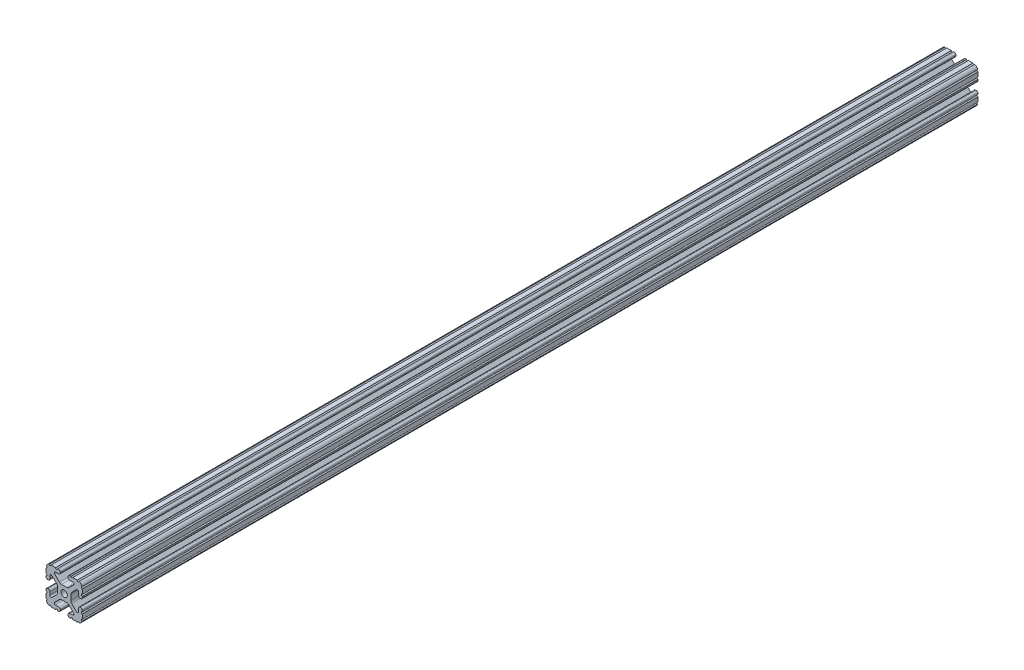
from build123d import *

# Parameters (mm, degrees)
BOSS_EXTRUDE1_DEPTH     = 469.9
CUT_EXTRUDE1_DEPTH      = 471.671663689
CUT_EXTRUDE1_DEPTH_BACK = 471.671663689
SKETCH5_R               = 1.016


with BuildPart() as part:
    # Sketch4 → Boss-Extrude1 (new, symmetric)
    with BuildSketch(Plane.XY):
        with BuildLine():
            Line((5.7912, -19.05), (14.3002, -19.05))
            ThreePointArc((14.3002, -19.05), (17.658815789, -17.658815789), (19.05, -14.3002))
            Line((19.05, -14.3002), (19.05, -5.7912))
            ThreePointArc((19.05, -5.7912), (18.544114832, -4.569885168), (17.3228, -4.064))
            Line((17.3228, -4.064), (16.7132, -4.064))
            ThreePointArc((16.7132, -4.064), (15.491885168, -4.569885168), (14.986, -5.7912))
            Line((14.986, -5.7912), (14.986, -8.996305235))
            ThreePointArc((14.986, -8.996305235), (14.189232738, -10.188751711), (12.782646215, -9.908964256))
            Line((12.782646215, -9.908964256), (7.888897763, -5.015215804))
            ThreePointArc((7.888897763, -5.015215804), (7.219915375, -4.014012907), (6.985, -2.833013566))
            Line((6.985, -2.833013566), (6.985, 0))
            Line((6.985, 0), (3.3274, 0))
            ThreePointArc((3.3274, 0), (2.352827104, -2.352827104), (0, -3.3274))
            Line((0, -3.3274), (0, -6.985))
            Line((0, -6.985), (2.833013566, -6.985))
            ThreePointArc((2.833013566, -6.985), (4.014012907, -7.219915375), (5.015215804, -7.888897763))
            Line((5.015215804, -7.888897763), (9.908964256, -12.782646215))
            ThreePointArc((9.908964256, -12.782646215), (10.188751711, -14.189232738), (8.996305235, -14.986))
            Line((8.996305235, -14.986), (5.7912, -14.986))
            ThreePointArc((5.7912, -14.986), (4.569885168, -15.491885168), (4.064, -16.7132))
            Line((4.064, -16.7132), (4.064, -17.3228))
            ThreePointArc((4.064, -17.3228), (4.569885168, -18.544114832), (5.7912, -19.05))
        make_face()
    extrude(amount=BOSS_EXTRUDE1_DEPTH, both=True)

    # Sketch5 → Cut-Extrude1 (cut, two sides: drawn at the far end of the back side and taken through both)
    with BuildSketch(Plane.XY.offset(-CUT_EXTRUDE1_DEPTH_BACK)):
        with Locations((14.739477062, -19.05)):
            Circle(SKETCH5_R)
        with Locations((7.980305235, -19.05)):
            Circle(SKETCH5_R)
        with Locations((19.05, -14.739477062)):
            Circle(SKETCH5_R)
        with Locations((19.05, -7.980305235)):
            Circle(SKETCH5_R)
    extrude(amount=CUT_EXTRUDE1_DEPTH + CUT_EXTRUDE1_DEPTH_BACK, mode=Mode.SUBTRACT)

    # Mirror1: part across plane


with BuildPart() as part_1:
    add(part.part)
    add(part.part.mirror(Plane(origin=(0, 0, 0), x_dir=(0, 0, 1), z_dir=(1, 0, 0))))

    # Mirror2: part across plane


with BuildPart() as part_2:
    add(part_1.part)
    add(part_1.part.mirror(Plane.ZX))


solid = part_2.part
